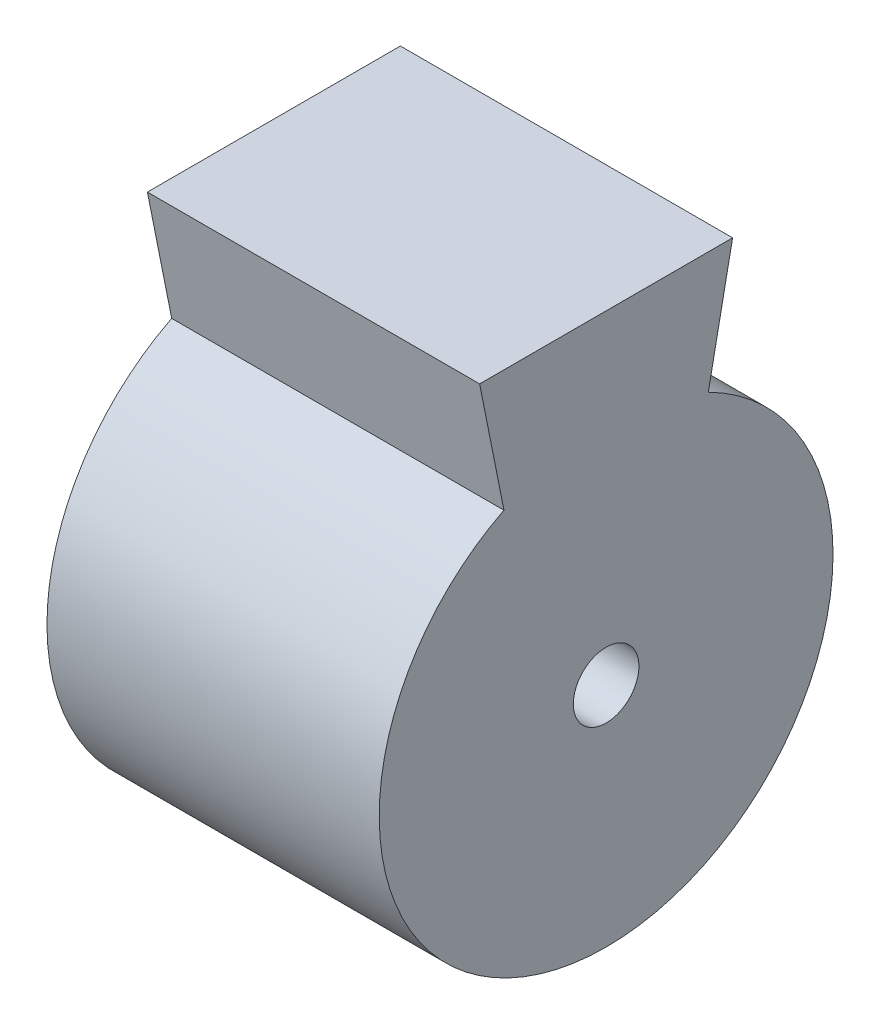
from build123d import *

# Parameters (mm, degrees)
BOSS_EXTRUDE1_DEPTH = 41
SKETCH2_R           = 10.05
CUT_EXTRUDE1_DEPTH  = 8.1
SKETCH3_R           = 4.05
CUT_EXTRUDE2_DEPTH  = 64.757352517


with BuildPart() as part:
    # Sketch1 → Boss-Extrude1 (new body)
    with BuildSketch(Plane(origin=(0, 0, 0), x_dir=(0, 0, -1), z_dir=(1, 0, 0))):
        with BuildLine():
            Line((-15.609520213, 40), (-12.609520213, 25))
            ThreePointArc((-12.609520213, 25), (0, -28), (12.609520213, 25))
            Line((12.609520213, 25), (15.609520213, 40))
            Line((15.609520213, 40), (-15.609520213, 40))
        make_face()
    extrude(amount=BOSS_EXTRUDE1_DEPTH)

    # Sketch2 → Cut-Extrude1 (cut)
    with BuildSketch(Plane(origin=(0, 0, 0), x_dir=(0, 0, -1), z_dir=(1, 0, 0))):
        Circle(SKETCH2_R)
    extrude(amount=CUT_EXTRUDE1_DEPTH, mode=Mode.SUBTRACT)

    # Sketch3 → Cut-Extrude2 (cut, through all)
    with BuildSketch(Plane(origin=(0, 0, 0), x_dir=(0, 0, -1), z_dir=(1, 0, 0))):
        Circle(SKETCH3_R)
    extrude(amount=CUT_EXTRUDE2_DEPTH, mode=Mode.SUBTRACT)


solid = part.part
